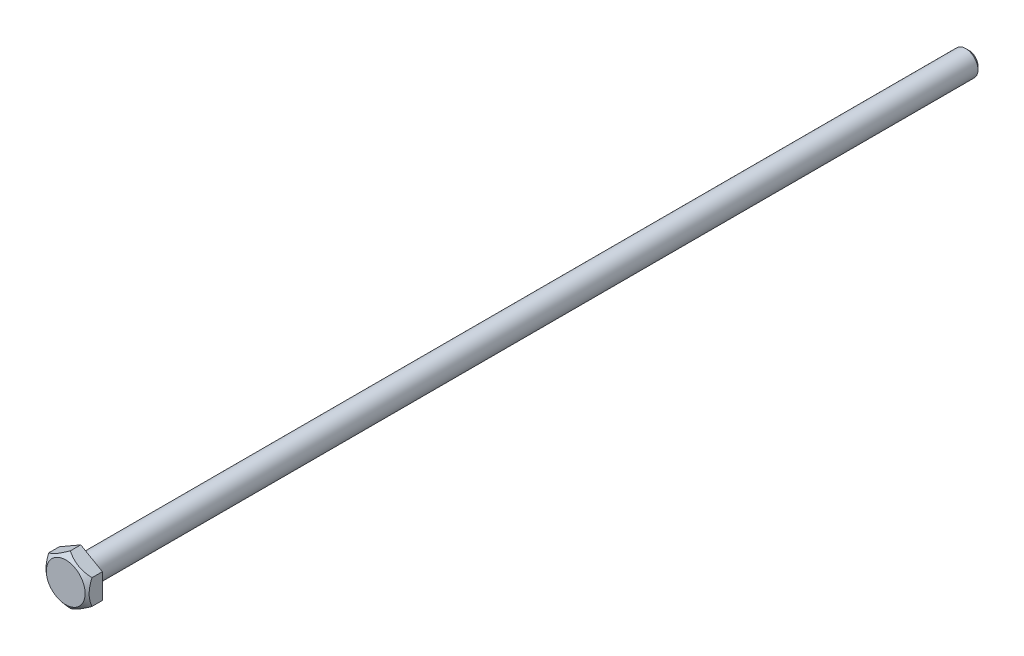
from build123d import *

# Parameters (mm, degrees)
BOSS_EXTRUDE1_DEPTH = 3.96875
SKETCH4_OUTSIDE_W   = 616.832
SKETCH4_OUTSIDE_H   = 618.552
SKETCH4_OUTSIDE_R   = 5.000625
CUT_EXTRUDE1_DEPTH  = 233.723565508
CUT_EXTRUDE1_DRAFT  = -50
SKETCH9_R           = 6.415804866
SKETCH9_R_2         = 5.2784375
CUT_EXTRUDE2_DEPTH  = 0.09921875


with BuildPart() as part:
    # Sketch2 → Revolve1 (revolve)
    with BuildSketch(Plane(origin=(0, 0, 0), x_dir=(0, 0, -1), z_dir=(1, 0, 0)), mode=Mode.PRIVATE) as revolve1_sk:
        Polygon((228.6, 0), (0, 0), (0, 3.175), (227.711, 3.175), (228.6, 2.286), align=None)
    revolve(revolve1_sk.sketch.rotate(Axis((0, 0, -228.6), (0, 0, 1)), 90), axis=Axis((0, 0, -228.6), (0, 0, 1)))

    # Sketch3 → Boss-Extrude1 (add)
    with BuildSketch(Plane.XY):
        Polygon((0, 6.415804866), (-5.55625, 3.207902433), (-5.55625, -3.207902433), (0, -6.415804866), (5.55625, -3.207902433), (5.55625, 3.207902433), align=None)
    extrude(amount=BOSS_EXTRUDE1_DEPTH)


with BuildPart() as cut_extrude1_tool:
    # Sketch4 outside → Cut-Extrude1 (with draft: the straight prism first)
    with BuildSketch(Plane.XY.offset(3.96875)):
        Rectangle(SKETCH4_OUTSIDE_W, SKETCH4_OUTSIDE_H)
        Circle(SKETCH4_OUTSIDE_R, mode=Mode.SUBTRACT)
    extrude(amount=-CUT_EXTRUDE1_DEPTH)
    # Cut-Extrude1: the draft: its side faces are tilted about the plane it starts from
    cut_extrude1_sides = [cut_extrude1_tool.faces().sort_by_distance(p)[0] for p in [
        (0, -309.276, -112.893032754),
        (308.416, 0, -112.893032754),
        (0, 309.276, -112.893032754),
        (-308.416, 0, -112.893032754),
        (-5.000625, 0, -112.893032754),
    ]]
    draft(cut_extrude1_sides, Plane.XY.offset(3.96875), CUT_EXTRUDE1_DRAFT)


with BuildPart() as part_1:
    add(part.part)

    # Cut-Extrude1: cut by cut_extrude1_tool
    add(cut_extrude1_tool.part, mode=Mode.SUBTRACT)

    # Sketch9 → Cut-Extrude2 (cut)
    with BuildSketch(Plane(origin=(0, 0, 0), x_dir=(-1, 0, 0), z_dir=(0, 0, -1))):
        Circle(SKETCH9_R)
        Circle(SKETCH9_R_2, mode=Mode.SUBTRACT)
    extrude(amount=-CUT_EXTRUDE2_DEPTH, mode=Mode.SUBTRACT)


solid = part_1.part
